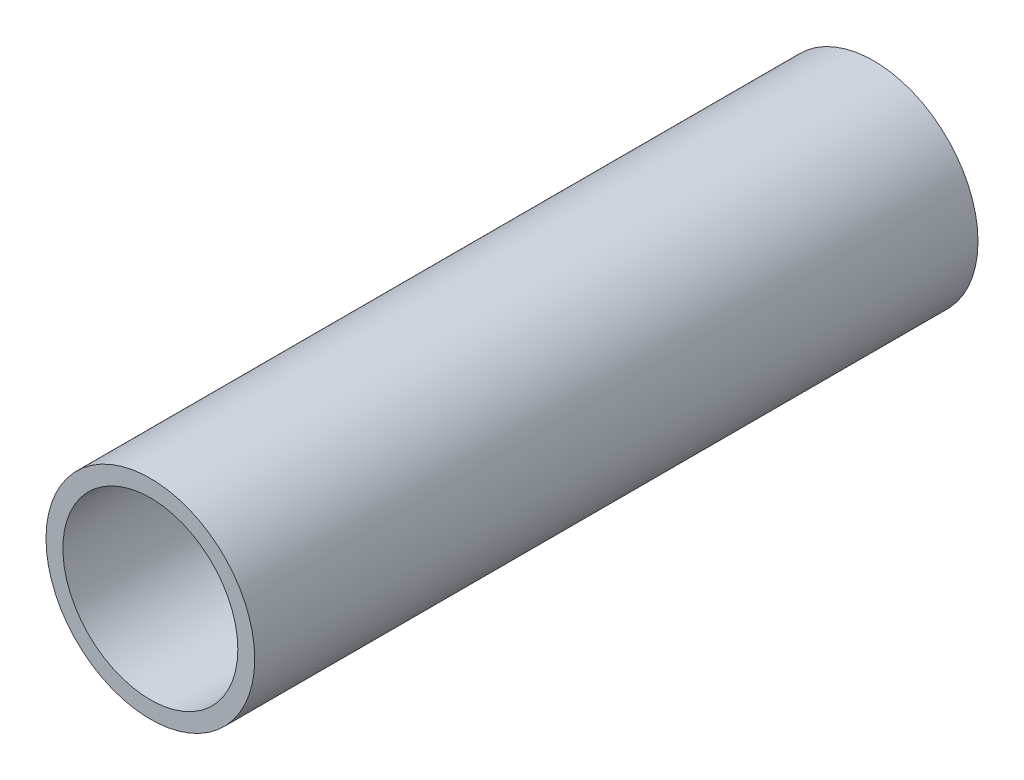
from build123d import *

# Parameters (mm, degrees)
SKETCH1_R           = 30.3
SKETCH1_R_2         = 25.4
BOSS_EXTRUDE1_DEPTH = 210


with BuildPart() as part:
    # Sketch1 → Boss-Extrude1 (new body)
    with BuildSketch(Plane.XY):
        Circle(SKETCH1_R)
        Circle(SKETCH1_R_2, mode=Mode.SUBTRACT)
    extrude(amount=BOSS_EXTRUDE1_DEPTH)


solid = part.part
